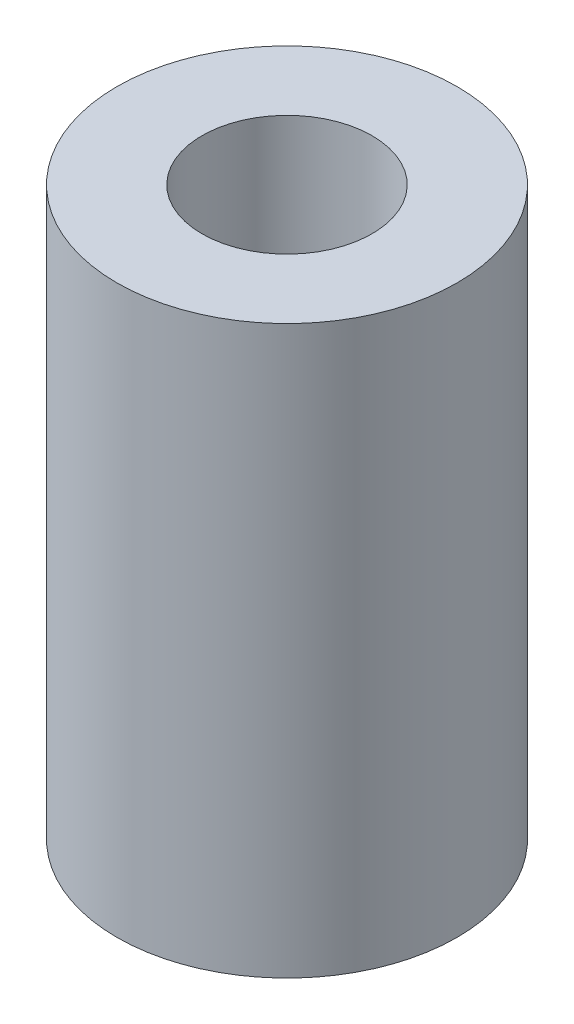
from build123d import *

# Parameters (mm, degrees)
SKETCH1_R           = 3
SKETCH1_R_2         = 1.5
BOSS_EXTRUDE1_DEPTH = 10


with BuildPart() as part:
    # Sketch1 → Boss-Extrude1 (new body)
    with BuildSketch(Plane(origin=(0, 0, 0), x_dir=(1, 0, 0), z_dir=(0, 1, 0))):
        with Locations(Location((0, 0, 0), (0, 0, 270))):
            Circle(SKETCH1_R)
        with Locations(Location((0, 0, 0), (0, 0, 270))):
            Circle(SKETCH1_R_2, mode=Mode.SUBTRACT)
    extrude(amount=BOSS_EXTRUDE1_DEPTH)


solid = part.part
